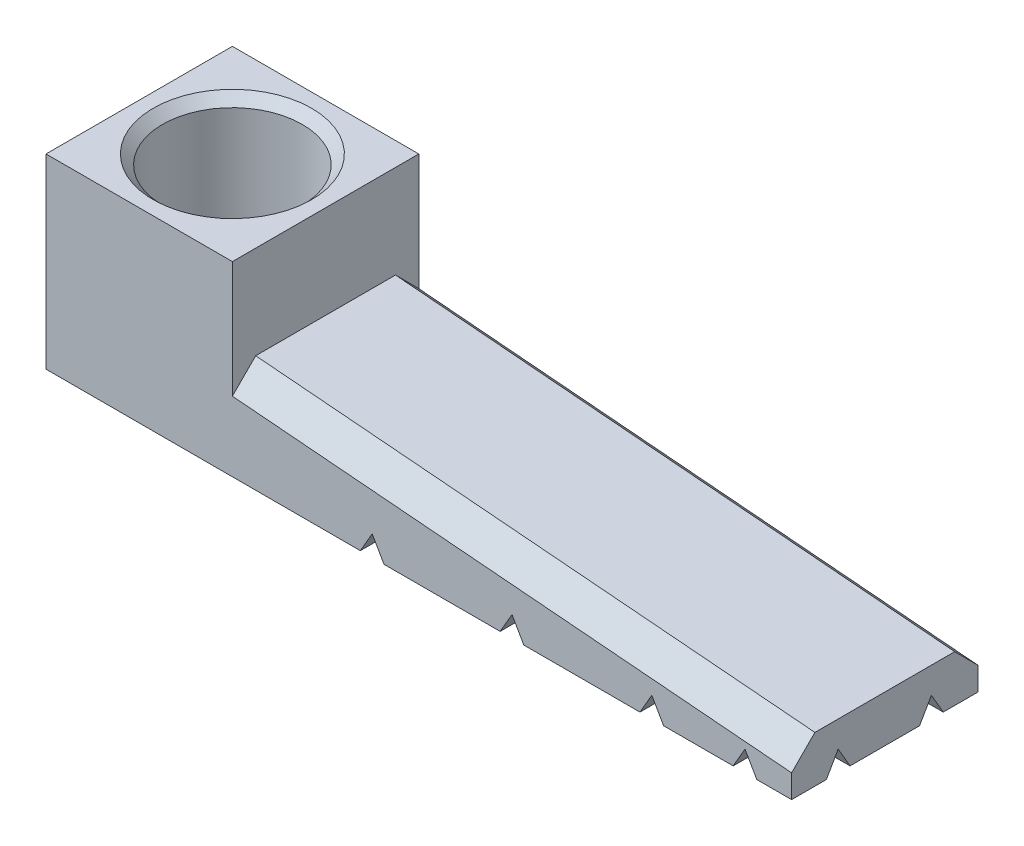
from build123d import *

# Parameters (mm, degrees)
BOSS_EXTRUDE1_DEPTH = 20
CHAMFER1_SIZE       = 2.5
SKETCH2_R           = 7.5
CUT_EXTRUDE1_DEPTH  = 85.852813742
CUT_EXTRUDE2_DEPTH  = 60
CUT_EXTRUDE3_DEPTH  = 85.852813742
CHAMFER2_SIZE       = 1


with BuildPart() as part:
    # Sketch1 → Boss-Extrude1 (new body)
    with BuildSketch(Plane.XY):
        Polygon((0, 0), (0, 20), (20, 20), (20, 10), (80, 5), (80, 0), align=None)
    extrude(amount=BOSS_EXTRUDE1_DEPTH)

    # Chamfer1
    chamfer1_edges = [part.edges().sort_by_distance(p)[0] for p in [
        (50, 7.5, 20),
        (50, 7.5, 0),
    ]]
    chamfer(chamfer1_edges, length=CHAMFER1_SIZE)

    # Sketch2 → Cut-Extrude1 (cut, through all)
    with BuildSketch(Plane(origin=(0, 0, 0), x_dir=(-1, 0, 0), z_dir=(0, -1, 0))):
        with Locations(Location((-10, -10, 0), (0, 0, 90))):
            Circle(SKETCH2_R)
    extrude(amount=-CUT_EXTRUDE1_DEPTH, mode=Mode.SUBTRACT)

    # Sketch3 → Cut-Extrude2 (cut)
    with BuildSketch(Plane(origin=(80, 0, 0), x_dir=(0, 0, -1), z_dir=(1, 0, 0))):
        Polygon((-15, 2.199704526), (-16.27, 0), (-13.73, 0), align=None)
        Polygon((-6.27, 0), (-5, 2.199704526), (-3.73, 0), align=None)
    extrude(amount=-CUT_EXTRUDE2_DEPTH, mode=Mode.SUBTRACT)

    # Sketch4 → Cut-Extrude3 (cut, through all)
    with BuildSketch(Plane.XY):
        Polygon((75, 2.199704526), (73.73, 0), (76.27, 0), align=None)
        Polygon((65, 2.199704526), (63.73, 0), (66.27, 0), align=None)
        Polygon((50, 2.199704526), (48.73, 0), (51.27, 0), align=None)
        Polygon((35, 2.199704526), (33.73, 0), (36.27, 0), align=None)
    extrude(amount=CUT_EXTRUDE3_DEPTH, mode=Mode.SUBTRACT)

    # Chamfer2
    chamfer2_edges = [part.edges().sort_by_distance(p)[0] for p in [
        (10, 20, 17.5),
        (10, 0, 17.5),
    ]]
    chamfer(chamfer2_edges, length=CHAMFER2_SIZE)


solid = part.part
